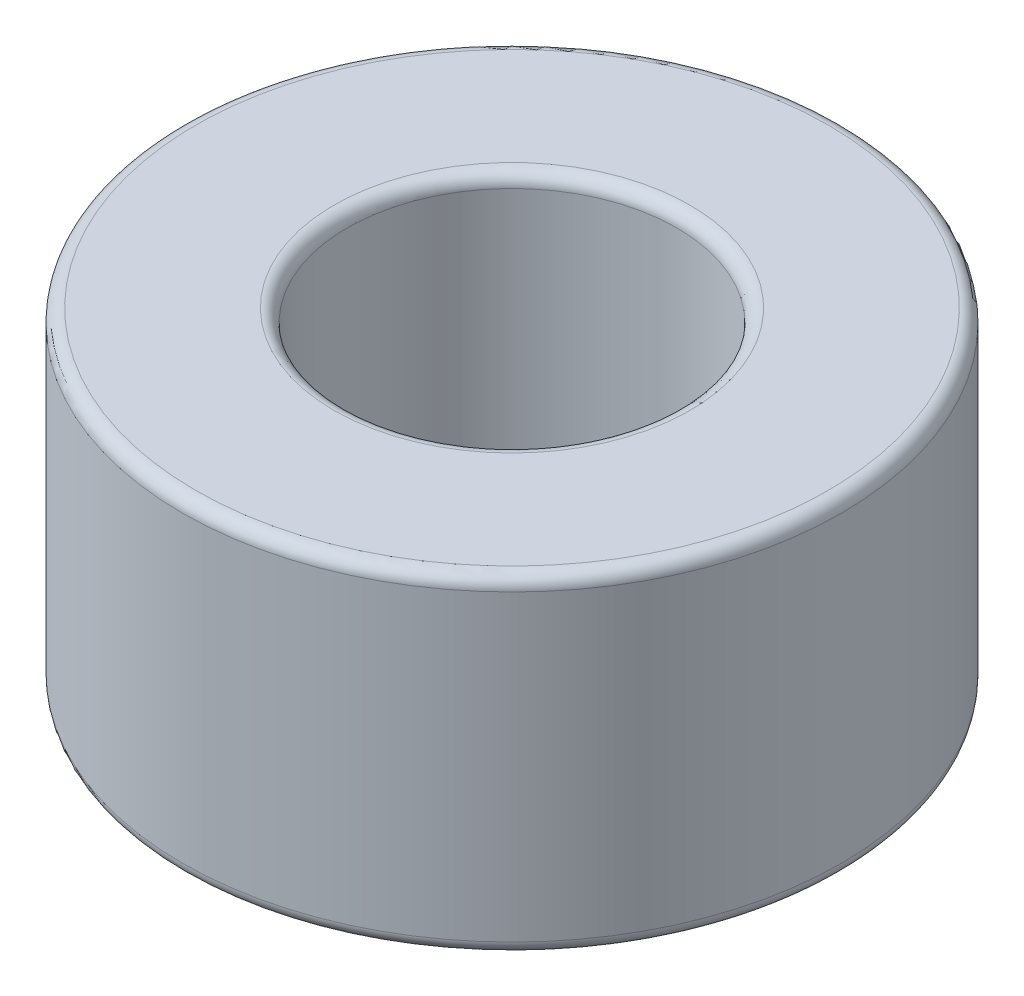
from build123d import *

# Parameters (mm, degrees)
SKETCH1_R           = 3.175
SKETCH1_R_2         = 1.5875
BOSS_EXTRUDE1_DEPTH = 1.5875
FILLET1_R           = 0.127


with BuildPart() as part:
    # Sketch1 → Boss-Extrude1 (new, symmetric)
    with BuildSketch(Plane(origin=(0, 0, 0), x_dir=(1, 0, 0), z_dir=(0, 1, 0))):
        with Locations(Location((0, 0, 0), (0, 0, 270))):
            Circle(SKETCH1_R)
        with Locations(Location((0, 0, 0), (0, 0, 270))):
            Circle(SKETCH1_R_2, mode=Mode.SUBTRACT)
    extrude(amount=BOSS_EXTRUDE1_DEPTH, both=True)

    # Fillet1
    fillet1_edges = [part.edges().sort_by_distance(p)[0] for p in [
        (0, -1.5875, -3.175),
        (0, 1.5875, -3.175),
        (0, -1.5875, -1.5875),
        (0, 1.5875, -1.5875),
    ]]
    fillet(fillet1_edges, radius=FILLET1_R)


solid = part.part
